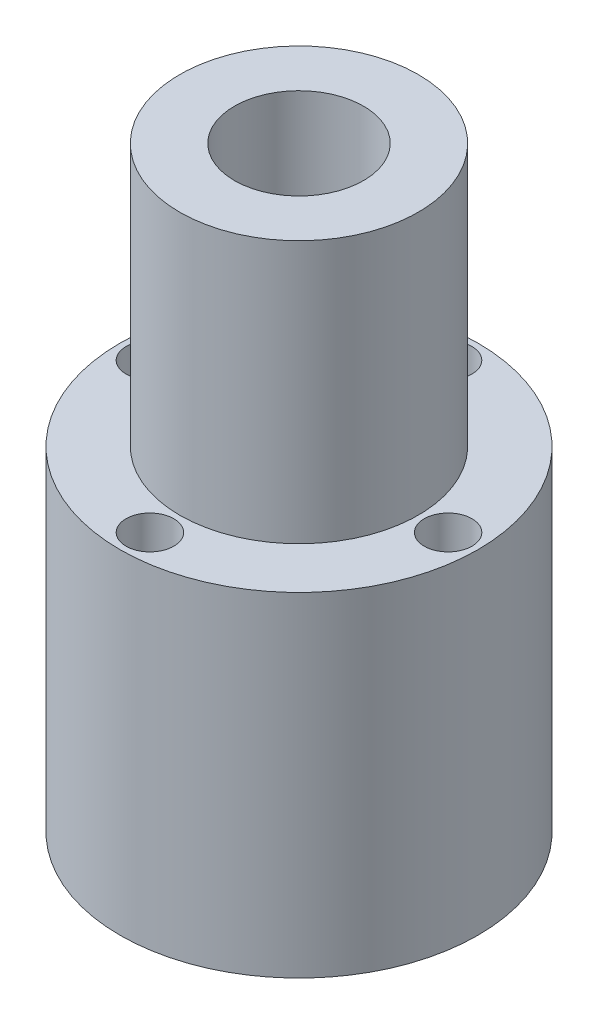
from build123d import *

# Parameters (mm, degrees)
SKETCH1_R           = 5
SKETCH1_R_2         = 2.7051
BOSS_EXTRUDE1_DEPTH = 11
SKETCH2_R           = 7.5
SKETCH2_R_2         = 1.75
SKETCH2_R_3         = 1
BOSS_EXTRUDE2_DEPTH = 14
CUT_EXTRUDE1_START  = -14
SKETCH3_R           = 2.1
CUT_EXTRUDE1_DEPTH  = 6


with BuildPart() as part:
    # Sketch1 → Boss-Extrude1 (new body)
    with BuildSketch(Plane(origin=(0, 0, 0), x_dir=(1, 0, 0), z_dir=(0, 1, 0))):
        with Locations(Location((0, 0, 0), (0, 0, 270))):
            Circle(SKETCH1_R)
        with Locations(Location((0, 0, 0), (0, 0, 270))):
            Circle(SKETCH1_R_2, mode=Mode.SUBTRACT)
    extrude(amount=BOSS_EXTRUDE1_DEPTH)

    # Sketch2 → Boss-Extrude2 (add)
    with BuildSketch(Plane(origin=(0, 0, 0), x_dir=(1, 0, 0), z_dir=(0, 1, 0))):
        with Locations(Location((0, 0, 0), (0, 0, 270))):
            Circle(SKETCH2_R)
        with Locations(Location((0, 0, 0), (0, 0, 270))):
            Circle(SKETCH2_R_2, mode=Mode.SUBTRACT)
        with Locations(Location((0, 6.25, 0), (0, 0, 270))):
            Circle(SKETCH2_R_3, mode=Mode.SUBTRACT)
        with Locations(Location((6.25, 0, 0), (0, 0, 270))):
            Circle(SKETCH2_R_3, mode=Mode.SUBTRACT)
        with Locations(Location((0, -6.25, 0), (0, 0, 270))):
            Circle(SKETCH2_R_3, mode=Mode.SUBTRACT)
        with Locations(Location((-6.25, 0, 0), (0, 0, 270))):
            Circle(SKETCH2_R_3, mode=Mode.SUBTRACT)
    extrude(amount=-BOSS_EXTRUDE2_DEPTH)

    # Sketch3 → Cut-Extrude1 (cut)
    with BuildSketch(Plane(origin=(0, 0, 0), x_dir=(1, 0, 0), z_dir=(0, 1, 0)).offset(CUT_EXTRUDE1_START)):
        with Locations(Location((0, 0, 0), (0, 0, 270))):
            Circle(SKETCH3_R)
    extrude(amount=CUT_EXTRUDE1_DEPTH, mode=Mode.SUBTRACT)


solid = part.part
